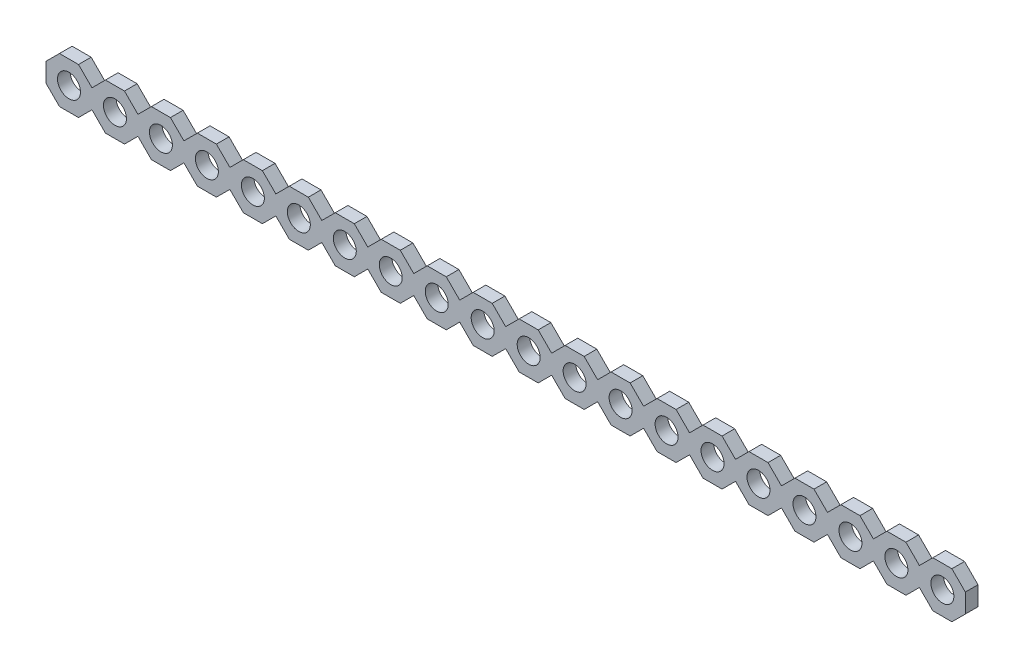
from build123d import *

# Parameters (mm, degrees)
ESQUISSE1_R                = 2
BOSS_EXTRU_1_DEPTH         = 2.2
R_P_TITION_LIN_AIRE1_COUNT = 20
R_P_TITION_LIN_AIRE1_PITCH = 8


with BuildPart() as part:
    # Esquisse1 → Boss.-Extru.1 (new body)
    with BuildSketch(Plane.XY):
        Polygon((-1.656854249, -4), (1.656854249, -4), (4, -1.656854249), (4, 1.656854249), (1.656854249, 4), (-1.656854249, 4), (-4, 1.656854249), (-4, -1.656854249), align=None)
        Circle(ESQUISSE1_R, mode=Mode.SUBTRACT)
    boss_extru_1 = extrude(amount=BOSS_EXTRU_1_DEPTH)

    # Répétition linéaire1: Boss.-Extru.1 ×20
    with Locations(*[(i * R_P_TITION_LIN_AIRE1_PITCH, 0, 0) for i in range(1, R_P_TITION_LIN_AIRE1_COUNT)]):
        add(boss_extru_1)


solid = part.part
